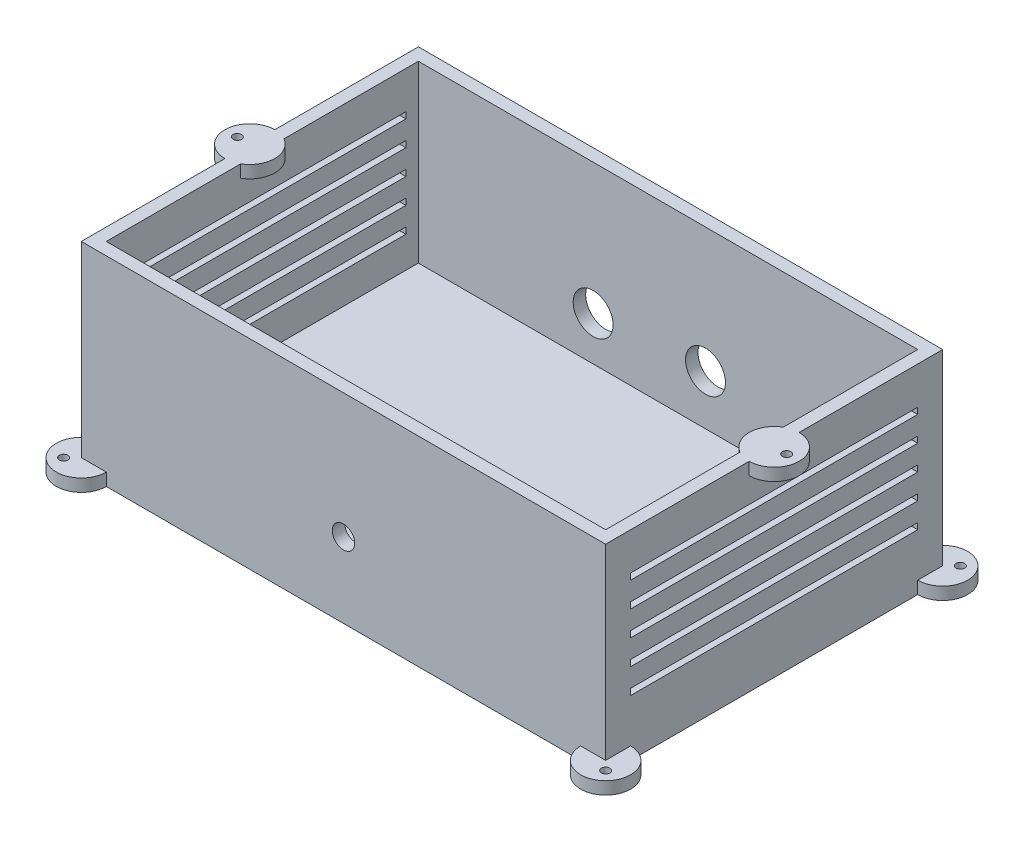
from build123d import *

# Parameters (mm, degrees)
SKETCH1_W           = 200
SKETCH1_H           = 125
BOSS_EXTRUDE1_DEPTH = 70
SKETCH2_W           = 210
SKETCH2_H           = 135
BOSS_EXTRUDE2_DEPTH = 10
SKETCH3_R           = 10
BOSS_EXTRUDE5_DEPTH = 5
CUT_EXTRUDE2_DEPTH  = 5
CUT_EXTRUDE3_DEPTH  = 10
SKETCH10_W          = 10
SKETCH10_H          = 125
CUT_EXTRUDE4_DEPTH  = 10
BOSS_EXTRUDE6_DEPTH = 5
SKETCH12_R          = 8
CUT_EXTRUDE5_DEPTH  = 10
SKETCH15_R          = 4.5
CUT_EXTRUDE6_DEPTH  = 10
SKETCH18_W          = 115
SKETCH18_H          = 2.5
CUT_EXTRUDE7_DEPTH  = 220


with BuildPart() as part:
    # Sketch1 → Boss-Extrude1 (new body)
    with BuildSketch(Plane(origin=(0, 0, 0), x_dir=(1, 0, 0), z_dir=(0, 1, 0))):
        Polygon((210, 0), (0, 0), (0, -135), (5, -135), (210, -135), align=None)
        with Locations((105, -67.5)):
            Rectangle(SKETCH1_W, SKETCH1_H, mode=Mode.SUBTRACT)
    extrude(amount=BOSS_EXTRUDE1_DEPTH)

    # Sketch2 → Boss-Extrude2 (add)
    with BuildSketch(Plane(origin=(0, 0, 0), x_dir=(-1, 0, 0), z_dir=(0, -1, 0))):
        with Locations((-105, -67.5)):
            Rectangle(SKETCH2_W, SKETCH2_H)
    extrude(amount=BOSS_EXTRUDE2_DEPTH)

    # Sketch3 → Boss-Extrude5 (add)
    with BuildSketch(Plane(origin=(0, -10, 0), x_dir=(-1, 0, 0), z_dir=(0, -1, 0))):
        with Locations((-210, 0)):
            Circle(SKETCH3_R)
        Circle(SKETCH3_R)
        with Locations((0, -135)):
            Circle(SKETCH3_R)
        with Locations((-210, -135)):
            Circle(SKETCH3_R)
    extrude(amount=-BOSS_EXTRUDE5_DEPTH)

    # Sketch7 → Cut-Extrude2 (cut)
    with BuildSketch(Plane(origin=(0, -5, 0), x_dir=(1, 0, 0), z_dir=(0, 1, 0))):
        with BuildLine():
            ThreePointArc((215.235533906, -138.535533906), (214.186095741, -136.964938701), (212.333452378, -137.333452378))
            Line((212.333452378, -137.333452378), (214.737615434, -139.737615434))
            ThreePointArc((214.737615434, -139.737615434), (215.106129111, -139.186095741), (215.235533906, -138.535533906))
        make_face()
        with BuildLine():
            Line((214.737615434, -139.737615434), (212.333452378, -137.333452378))
            ThreePointArc((212.333452378, -137.333452378), (212.333452378, -139.737615434), (214.737615434, -139.737615434))
        make_face()
        with BuildLine():
            ThreePointArc((214.737615434, 4.737615434), (212.333452378, 4.737615434), (212.333452378, 2.333452378))
            Line((212.333452378, 2.333452378), (214.737615434, 4.737615434))
        make_face()
        with BuildLine():
            Line((214.737615434, 4.737615434), (212.333452378, 2.333452378))
            ThreePointArc((212.333452378, 2.333452378), (214.186095741, 1.964938701), (215.235533906, 3.535533906))
            ThreePointArc((215.235533906, 3.535533906), (215.106129111, 4.186095741), (214.737615434, 4.737615434))
        make_face()
        with BuildLine():
            ThreePointArc((-4.737615434, 4.737615434), (-4.737615434, 2.333452378), (-2.333452378, 2.333452378))
            Line((-2.333452378, 2.333452378), (-4.737615434, 4.737615434))
        make_face()
        with BuildLine():
            Line((-4.737615434, 4.737615434), (-2.333452378, 2.333452378))
            ThreePointArc((-2.333452378, 2.333452378), (-1.964938701, 2.884972071), (-1.835533906, 3.535533906))
            ThreePointArc((-1.835533906, 3.535533906), (-2.884972071, 5.106129111), (-4.737615434, 4.737615434))
        make_face()
        with BuildLine():
            ThreePointArc((-1.835533906, -138.535533906), (-1.964938701, -137.884972071), (-2.333452378, -137.333452378))
            Line((-2.333452378, -137.333452378), (-4.737615434, -139.737615434))
            ThreePointArc((-4.737615434, -139.737615434), (-2.884972071, -140.106129111), (-1.835533906, -138.535533906))
        make_face()
        with BuildLine():
            Line((-4.737615434, -139.737615434), (-2.333452378, -137.333452378))
            ThreePointArc((-2.333452378, -137.333452378), (-4.737615434, -137.333452378), (-4.737615434, -139.737615434))
        make_face()
    extrude(amount=-CUT_EXTRUDE2_DEPTH, mode=Mode.SUBTRACT)

    # Sketch9 → Cut-Extrude3 (cut)
    with BuildSketch(Plane(origin=(0, 0, 0), x_dir=(1, 0, 0), z_dir=(0, 1, 0))):
        Polygon((195, -130), (200, -125), (205, -120), (205, -15), (200, -10), (195, -5), align=None)
    extrude(amount=-CUT_EXTRUDE3_DEPTH, mode=Mode.SUBTRACT)

    # Sketch10 → Cut-Extrude4 (cut)
    with BuildSketch(Plane(origin=(0, 0, 0), x_dir=(1, 0, 0), z_dir=(0, 1, 0))):
        with Locations((190, -67.5)):
            Rectangle(SKETCH10_W, SKETCH10_H)
    extrude(amount=-CUT_EXTRUDE4_DEPTH, mode=Mode.SUBTRACT)

    # Sketch11 → Boss-Extrude6 (add)
    with BuildSketch(Plane(origin=(0, 70, 0), x_dir=(1, 0, 0), z_dir=(0, 1, 0))):
        with BuildLine():
            ThreePointArc((213.3, -67.5), (215, -65.8), (216.7, -67.5))
            Line((216.7, -67.5), (220, -67.5))
            ThreePointArc((220, -67.5), (217.071067812, -60.428932188), (210, -57.5))
            Line((210, -57.5), (210, -67.5))
            Line((210, -67.5), (213.3, -67.5))
        make_face()
        with BuildLine():
            Line((220, -67.5), (216.7, -67.5))
            ThreePointArc((216.7, -67.5), (215, -69.2), (213.3, -67.5))
            Line((213.3, -67.5), (210, -67.5))
            Line((210, -67.5), (210, -77.5))
            ThreePointArc((210, -77.5), (217.071067812, -74.571067812), (220, -67.5))
        make_face()
        with BuildLine():
            Line((205, -76.160254038), (205, -58.839745962))
            ThreePointArc((205, -58.839745962), (200, -67.5), (205, -76.160254038))
        make_face()
        with BuildLine():
            Line((210, -67.5), (210, -57.5))
            ThreePointArc((210, -57.5), (207.411809549, -57.840741737), (205, -58.839745962))
            Line((205, -58.839745962), (205, -76.160254038))
            ThreePointArc((205, -76.160254038), (207.411809549, -77.159258263), (210, -77.5))
            Line((210, -77.5), (210, -67.5))
        make_face()
        with BuildLine():
            ThreePointArc((10, -67.5), (8.660254038, -62.5), (5, -58.839745962))
            Line((5, -58.839745962), (5, -76.160254038))
            ThreePointArc((5, -76.160254038), (8.660254038, -72.5), (10, -67.5))
        make_face()
        with BuildLine():
            Line((0, -57.5), (0, -67.5))
            Line((0, -67.5), (0, -77.5))
            ThreePointArc((0, -77.5), (2.588190451, -77.159258263), (5, -76.160254038))
            Line((5, -76.160254038), (5, -58.839745962))
            ThreePointArc((5, -58.839745962), (2.588190451, -57.840741737), (0, -57.5))
        make_face()
        with BuildLine():
            Line((0, -77.5), (0, -67.5))
            Line((0, -67.5), (-3.3, -67.5))
            ThreePointArc((-3.3, -67.5), (-5, -69.2), (-6.7, -67.5))
            Line((-6.7, -67.5), (-10, -67.5))
            ThreePointArc((-10, -67.5), (-7.071067812, -74.571067812), (0, -77.5))
        make_face()
        with BuildLine():
            Line((-3.3, -67.5), (0, -67.5))
            Line((0, -67.5), (0, -57.5))
            ThreePointArc((0, -57.5), (-7.071067812, -60.428932188), (-10, -67.5))
            Line((-10, -67.5), (-6.7, -67.5))
            ThreePointArc((-6.7, -67.5), (-5, -65.8), (-3.3, -67.5))
        make_face()
    extrude(amount=-BOSS_EXTRUDE6_DEPTH)

    # Sketch12 → Cut-Extrude5 (cut)
    with BuildSketch(Plane(origin=(0, 0, 0), x_dir=(-1, 0, 0), z_dir=(0, 0, -1))):
        with Locations((-75, 17.5)):
            Circle(SKETCH12_R)
        with Locations((-120, 20)):
            Circle(SKETCH12_R)
    extrude(amount=-CUT_EXTRUDE5_DEPTH, mode=Mode.SUBTRACT)

    # Sketch15 → Cut-Extrude6 (cut)
    with BuildSketch(Plane.XY.offset(135)):
        with Locations((105, 20)):
            Circle(SKETCH15_R)
    extrude(amount=-CUT_EXTRUDE6_DEPTH, mode=Mode.SUBTRACT)

    # Sketch18 → Cut-Extrude7 (cut)
    with BuildSketch(Plane(origin=(210, 0, 0), x_dir=(0, 0, -1), z_dir=(1, 0, 0))):
        with Locations((-67.5, 43.75)):
            Rectangle(SKETCH18_W, SKETCH18_H)
        with Locations((-67.5, 53.75)):
            Rectangle(SKETCH18_W, SKETCH18_H)
        with Locations((-67.5, 33.75)):
            Rectangle(SKETCH18_W, SKETCH18_H)
        with Locations((-67.5, 23.75)):
            Rectangle(SKETCH18_W, SKETCH18_H)
        with Locations((-67.5, 13.75)):
            Rectangle(SKETCH18_W, SKETCH18_H)
    extrude(amount=-CUT_EXTRUDE7_DEPTH, mode=Mode.SUBTRACT)


solid = part.part
